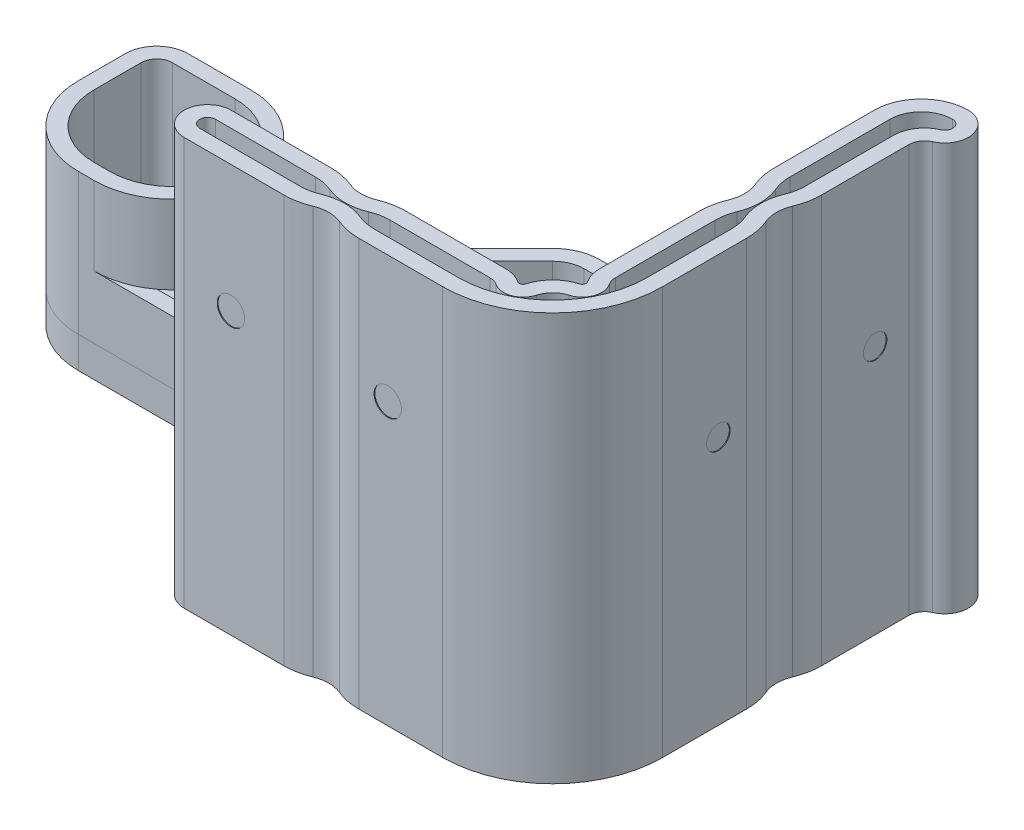
from build123d import *

# Parameters (mm, degrees)
SKETCH1_R           = 12
SKETCH1_R_2         = 2
SKETCH1_R_3         = 3
SKETCH1_R_4         = 3.05
BOSS_EXTRUDE1_DEPTH = 4
EXTRUDE_THIN1_DEPTH = 8
EXTRUDE_THIN2_DEPTH = 8
EXTRUDE_THIN3_DEPTH = 10
EXTRUDE_THIN4_DEPTH = 52
SKETCH9_R           = 1.75
CUT_EXTRUDE1_DEPTH  = 0.1
SKETCH10_R          = 1.5
SKETCH10_R_2        = 1.500000007
CUT_EXTRUDE2_DEPTH  = 0.1


with BuildPart() as part:
    # Sketch1 → Boss-Extrude1 (new body)
    with BuildSketch(Plane(origin=(0, 0, 0), x_dir=(1, 0, 0), z_dir=(0, 1, 0))):
        with BuildLine():
            Line((-56.5, 10), (-37.638467591, 10))
            ThreePointArc((-37.638467591, 10), (-33.814526369, 10.760006843), (-30.571829447, 12.924505293))
            Line((-30.571829447, 12.924505293), (-21.739982886, 21.745296824))
            ThreePointArc((-21.739982886, 21.745296824), (-19.794364733, 23.043995894), (-17.5, 23.5))
            Line((-17.5, 23.5), (17.5, 23.5))
            ThreePointArc((17.5, 23.5), (21.742640687, 21.742640687), (23.5, 17.5))
            Line((23.5, 17.5), (23.5, -17.5))
            ThreePointArc((23.5, -17.5), (21.742640687, -21.742640687), (17.5, -23.5))
            Line((17.5, -23.5), (-17.5, -23.5))
            ThreePointArc((-17.5, -23.5), (-19.794364733, -23.043995894), (-21.739982886, -21.745296824))
            Line((-21.739982886, -21.745296824), (-30.571829447, -12.924505293))
            ThreePointArc((-30.571829447, -12.924505293), (-33.814526369, -10.760006843), (-37.638467591, -10))
            Line((-37.638467591, -10), (-50.5, -10))
            ThreePointArc((-50.5, -10), (-57.571067812, -7.071067812), (-60.5, 0))
            Line((-60.5, 0), (-60.5, 6))
            ThreePointArc((-60.5, 6), (-59.328427125, 8.828427125), (-56.5, 10))
        make_face()
        with Locations(Location((0, 0, 0), (0, 0, 270))):
            Circle(SKETCH1_R, mode=Mode.SUBTRACT)
        with Locations(Location((-15.637811111, 15.662146765, 0), (0, 0, 270))):
            Circle(SKETCH1_R_2, mode=Mode.SUBTRACT)
        with Locations(Location((15.662146765, 15.637811111, 0), (0, 0, 270))):
            Circle(SKETCH1_R_2, mode=Mode.SUBTRACT)
        with Locations(Location((15.637811111, -15.662146765, 0), (0, 0, 270))):
            Circle(SKETCH1_R_2, mode=Mode.SUBTRACT)
        with Locations(Location((-15.662146765, -15.637811111, 0), (0, 0, 270))):
            Circle(SKETCH1_R_2, mode=Mode.SUBTRACT)
        with Locations(Location((-53.5, 0, 0), (0, 0, 270))):
            Circle(SKETCH1_R_3, mode=Mode.SUBTRACT)
        with Locations(Location((-33.5, 0, 0), (0, 0, 270))):
            Circle(SKETCH1_R_4, mode=Mode.SUBTRACT)
        with BuildLine():
            Line((19.5, -3), (19.5, -9.206263146))
            ThreePointArc((19.5, -9.206263146), (19.041462955, -10.046987755), (18.086364264, -10.116705609))
            ThreePointArc((18.086364264, -10.116705609), (16.465532816, -9.638381302), (14.7756495, -9.624849747))
            ThreePointArc((14.7756495, -9.624849747), (13.810727907, -9.185503496), (13.78311178, -8.125627956))
            ThreePointArc((13.78311178, -8.125627956), (14.868163127, -5.910814262), (15.599936689, -3.555555556))
            ThreePointArc((15.599936689, -3.555555556), (16.302709646, -2.43652808), (17.549928775, -2))
            Line((17.549928775, -2), (18.5, -2))
            ThreePointArc((18.5, -2), (19.207106781, -2.292893219), (19.5, -3))
        make_face(mode=Mode.SUBTRACT)
        with BuildLine():
            Line((19.5, 9.206263146), (19.5, 3))
            ThreePointArc((19.5, 3), (19.207106781, 2.292893219), (18.5, 2))
            Line((18.5, 2), (17.549928775, 2))
            ThreePointArc((17.549928775, 2), (16.302709646, 2.43652808), (15.599936689, 3.555555556))
            ThreePointArc((15.599936689, 3.555555556), (14.868163127, 5.910814262), (13.78311178, 8.125627956))
            ThreePointArc((13.78311178, 8.125627956), (13.810727907, 9.185503495), (14.7756495, 9.624849747))
            ThreePointArc((14.7756495, 9.624849747), (16.465532816, 9.638381302), (18.086364264, 10.116705609))
            ThreePointArc((18.086364264, 10.116705609), (19.041462955, 10.046987755), (19.5, 9.206263146))
        make_face(mode=Mode.SUBTRACT)
        with BuildLine():
            Line((-47.234448237, 5.968935344), (-39.813106892, 5.999991244))
            ThreePointArc((-39.813106892, 5.999991244), (-38.909524399, 5.437130986), (-39.025205203, 4.378881988))
            ThreePointArc((-39.025205203, 4.378881988), (-40.55, 0), (-39.025205203, -4.378881988))
            ThreePointArc((-39.025205203, -4.378881988), (-38.909524399, -5.437130986), (-39.813106892, -5.999991244))
            Line((-39.813106892, -5.999991244), (-47.234448237, -5.968935344))
            ThreePointArc((-47.234448237, -5.968935344), (-48.131482814, -5.402307604), (-48.013980649, -4.347826087))
            ThreePointArc((-48.013980649, -4.347826087), (-46.5, 0), (-48.013980649, 4.347826087))
            ThreePointArc((-48.013980649, 4.347826087), (-48.131482814, 5.402307604), (-47.234448237, 5.968935344))
        make_face(mode=Mode.SUBTRACT)
        with BuildLine():
            Line((-3, -19.5), (-9.206263146, -19.5))
            ThreePointArc((-9.206263146, -19.5), (-10.046987755, -19.041462955), (-10.116705609, -18.086364264))
            ThreePointArc((-10.116705609, -18.086364264), (-9.638381302, -16.465532816), (-9.624849747, -14.7756495))
            ThreePointArc((-9.624849747, -14.7756495), (-9.185503496, -13.810727907), (-8.125627956, -13.78311178))
            ThreePointArc((-8.125627956, -13.78311178), (-5.910814262, -14.868163127), (-3.555555556, -15.599936689))
            ThreePointArc((-3.555555556, -15.599936689), (-2.43652808, -16.302709646), (-2, -17.549928775))
            Line((-2, -17.549928775), (-2, -18.5))
            ThreePointArc((-2, -18.5), (-2.292893219, -19.207106781), (-3, -19.5))
        make_face(mode=Mode.SUBTRACT)
        with BuildLine():
            Line((9.206263146, -19.5), (3, -19.5))
            ThreePointArc((3, -19.5), (2.292893219, -19.207106781), (2, -18.5))
            Line((2, -18.5), (2, -17.549928775))
            ThreePointArc((2, -17.549928775), (2.43652808, -16.302709646), (3.555555556, -15.599936689))
            ThreePointArc((3.555555556, -15.599936689), (5.910814262, -14.868163127), (8.125627956, -13.78311178))
            ThreePointArc((8.125627956, -13.78311178), (9.185503495, -13.810727907), (9.624849747, -14.7756495))
            ThreePointArc((9.624849747, -14.7756495), (9.638381302, -16.465532816), (10.116705609, -18.086364264))
            ThreePointArc((10.116705609, -18.086364264), (10.046987755, -19.041462955), (9.206263146, -19.5))
        make_face(mode=Mode.SUBTRACT)
        with BuildLine():
            Line((-19.5, 3), (-19.5, 9.206263146))
            ThreePointArc((-19.5, 9.206263146), (-19.041462955, 10.046987755), (-18.086364264, 10.116705609))
            ThreePointArc((-18.086364264, 10.116705609), (-16.465532816, 9.638381302), (-14.7756495, 9.624849747))
            ThreePointArc((-14.7756495, 9.624849747), (-13.810727907, 9.185503496), (-13.78311178, 8.125627956))
            ThreePointArc((-13.78311178, 8.125627956), (-14.868163127, 5.910814262), (-15.599936689, 3.555555556))
            ThreePointArc((-15.599936689, 3.555555556), (-16.302709646, 2.43652808), (-17.549928775, 2))
            Line((-17.549928775, 2), (-18.5, 2))
            ThreePointArc((-18.5, 2), (-19.207106781, 2.292893219), (-19.5, 3))
        make_face(mode=Mode.SUBTRACT)
        with BuildLine():
            Line((-19.5, -9.206263146), (-19.5, -3))
            ThreePointArc((-19.5, -3), (-19.207106781, -2.292893219), (-18.5, -2))
            Line((-18.5, -2), (-17.549928775, -2))
            ThreePointArc((-17.549928775, -2), (-16.302709646, -2.43652808), (-15.599936689, -3.555555556))
            ThreePointArc((-15.599936689, -3.555555556), (-14.868163127, -5.910814262), (-13.78311178, -8.125627956))
            ThreePointArc((-13.78311178, -8.125627956), (-13.810727907, -9.185503495), (-14.7756495, -9.624849747))
            ThreePointArc((-14.7756495, -9.624849747), (-16.465532816, -9.638381302), (-18.086364264, -10.116705609))
            ThreePointArc((-18.086364264, -10.116705609), (-19.041462955, -10.046987755), (-19.5, -9.206263146))
        make_face(mode=Mode.SUBTRACT)
        with BuildLine():
            Line((-9.206263146, 19.5), (-3, 19.5))
            ThreePointArc((-3, 19.5), (-2.292893219, 19.207106781), (-2, 18.5))
            Line((-2, 18.5), (-2, 17.549928775))
            ThreePointArc((-2, 17.549928775), (-2.43652808, 16.302709646), (-3.555555556, 15.599936689))
            ThreePointArc((-3.555555556, 15.599936689), (-5.910814262, 14.868163127), (-8.125627956, 13.78311178))
            ThreePointArc((-8.125627956, 13.78311178), (-9.185503495, 13.810727907), (-9.624849747, 14.7756495))
            ThreePointArc((-9.624849747, 14.7756495), (-9.638381302, 16.465532816), (-10.116705609, 18.086364264))
            ThreePointArc((-10.116705609, 18.086364264), (-10.046987755, 19.041462955), (-9.206263146, 19.5))
        make_face(mode=Mode.SUBTRACT)
        with BuildLine():
            Line((2, 18.5), (2, 17.549928775))
            ThreePointArc((2, 17.549928775), (2.43652808, 16.302709646), (3.555555556, 15.599936689))
            ThreePointArc((3.555555556, 15.599936689), (5.910814262, 14.868163127), (8.125627956, 13.78311178))
            ThreePointArc((8.125627956, 13.78311178), (9.185503495, 13.810727907), (9.624849747, 14.7756495))
            ThreePointArc((9.624849747, 14.7756495), (9.638381302, 16.465532816), (10.116705609, 18.086364264))
            ThreePointArc((10.116705609, 18.086364264), (10.046987755, 19.041462955), (9.206263146, 19.5))
            Line((9.206263146, 19.5), (3, 19.5))
            ThreePointArc((3, 19.5), (2.292893219, 19.207106781), (2, 18.5))
        make_face(mode=Mode.SUBTRACT)
        with BuildLine():
            Line((-23.5, -3), (-23.5, -11.922090802))
            ThreePointArc((-23.5, -11.922090802), (-24.117027295, -12.845850461), (-25.206663814, -12.629640272))
            Line((-25.206663814, -12.629640272), (-30.170133033, -7.672383945))
            ThreePointArc((-30.170133033, -7.672383945), (-30.455062302, -6.835439125), (-29.964901614, -6.099637645))
            ThreePointArc((-29.964901614, -6.099637645), (-28.170653661, -4.615253795), (-26.95785652, -2.627329193))
            ThreePointArc((-26.95785652, -2.627329193), (-26.589950578, -2.171546378), (-26.029892906, -2))
            Line((-26.029892906, -2), (-24.5, -2))
            ThreePointArc((-24.5, -2), (-23.792893219, -2.292893219), (-23.5, -3))
        make_face(mode=Mode.SUBTRACT)
        with BuildLine():
            Line((-25.206663814, 12.629640272), (-30.170133033, 7.672383945))
            ThreePointArc((-30.170133033, 7.672383945), (-30.455062302, 6.835439125), (-29.964901614, 6.099637645))
            ThreePointArc((-29.964901614, 6.099637645), (-28.170653661, 4.615253795), (-26.95785652, 2.627329193))
            ThreePointArc((-26.95785652, 2.627329193), (-26.589950578, 2.171546378), (-26.029892906, 2))
            Line((-26.029892906, 2), (-24.5, 2))
            ThreePointArc((-24.5, 2), (-23.792893219, 2.292893219), (-23.5, 3))
            Line((-23.5, 3), (-23.5, 11.922090802))
            ThreePointArc((-23.5, 11.922090802), (-24.117027295, 12.845850461), (-25.206663814, 12.629640272))
        make_face(mode=Mode.SUBTRACT)
    extrude(amount=BOSS_EXTRUDE1_DEPTH)


with BuildPart() as body_2:
    # Sketch4 → Extrude-Thin1 (new body)
    with BuildSketch(Plane(origin=(0, 4, 0), x_dir=(1, 0, 0), z_dir=(0, 1, 0))):
        with BuildLine():
            Line((-21.739982886, 21.745296824), (-30.571829447, 12.924505293))
            ThreePointArc((-30.571829447, 12.924505293), (-33.814526369, 10.760006843), (-37.638467591, 10))
            Line((-37.638467591, 10), (-56.5, 10))
            ThreePointArc((-56.5, 10), (-59.328427125, 8.828427125), (-60.5, 6))
            Line((-60.5, 6), (-60.5, 0))
            ThreePointArc((-60.5, 0), (-57.571067812, -7.071067812), (-50.5, -10))
            Line((-50.5, -10), (-37.638467591, -10))
            ThreePointArc((-37.638467591, -10), (-33.814526369, -10.760006843), (-30.571829447, -12.924505293))
            Line((-30.571829447, -12.924505293), (-21.739982886, -21.745296824))
            ThreePointArc((-21.739982886, -21.745296824), (-19.794364733, -23.043995894), (-17.5, -23.5))
            Line((-17.5, -23.5), (17.5, -23.5))
            ThreePointArc((17.5, -23.5), (21.742640687, -21.742640687), (23.5, -17.5))
            Line((23.5, -17.5), (23.5, 17.5))
            ThreePointArc((23.5, 17.5), (21.742640687, 21.742640687), (17.5, 23.5))
            Line((17.5, 23.5), (-17.5, 23.5))
            ThreePointArc((-17.5, 23.5), (-19.794364733, 23.043995894), (-21.739982886, 21.745296824))
        make_face()
        with BuildLine():
            Line((-20.326655258, 20.330197883), (-29.158501818, 11.509406352))
            ThreePointArc((-29.158501818, 11.509406352), (-33.049738125, 8.912008212), (-37.638467591, 8))
            Line((-37.638467591, 8), (-56.5, 8))
            ThreePointArc((-56.5, 8), (-57.914213562, 7.414213562), (-58.5, 6))
            Line((-58.5, 6), (-58.5, 0))
            ThreePointArc((-58.5, 0), (-56.156854249, -5.656854249), (-50.5, -8))
            Line((-50.5, -8), (-37.638467591, -8))
            ThreePointArc((-37.638467591, -8), (-33.049738125, -8.912008212), (-29.158501818, -11.509406352))
            Line((-29.158501818, -11.509406352), (-20.326655258, -20.330197883))
            ThreePointArc((-20.326655258, -20.330197883), (-19.029576489, -21.195997263), (-17.5, -21.5))
            Line((-17.5, -21.5), (17.5, -21.5))
            ThreePointArc((17.5, -21.5), (20.328427125, -20.328427125), (21.5, -17.5))
            Line((21.5, -17.5), (21.5, 17.5))
            ThreePointArc((21.5, 17.5), (20.328427125, 20.328427125), (17.5, 21.5))
            Line((17.5, 21.5), (-17.5, 21.5))
            ThreePointArc((-17.5, 21.5), (-19.029576489, 21.195997263), (-20.326655258, 20.330197883))
        make_face(mode=Mode.SUBTRACT)
    extrude(amount=EXTRUDE_THIN1_DEPTH)



with BuildPart() as body_3:
    # Sketch5 → Extrude-Thin2 (new body)
    with BuildSketch(Plane(origin=(0, 4, 0), x_dir=(1, 0, 0), z_dir=(0, 1, 0))):
        with BuildLine():
            Line((-26.219991443, 14.302905651), (-29.087835437, 11.438651405))
            ThreePointArc((-29.087835437, 11.438651405), (-30.624783425, 10.140069248), (-32.355673589, 9.114133588))
            Line((-32.355673589, 9.114133588), (-36.861778001, 6.927369535))
            ThreePointArc((-36.861778001, 6.927369535), (-41.2, 0), (-36.861778001, -6.927369535))
            Line((-36.861778001, -6.927369535), (-32.355673589, -9.114133588))
            ThreePointArc((-32.355673589, -9.114133588), (-30.624783425, -10.140069248), (-29.087835437, -11.438651405))
            Line((-29.087835437, -11.438651405), (-26.219991443, -14.302905651))
            ThreePointArc((-26.219991443, -14.302905651), (-22.951081885, -14.951536215), (-21.1, -12.180257239))
            Line((-21.1, -12.180257239), (-21.1, 12.180257239))
            ThreePointArc((-21.1, 12.180257239), (-22.951081885, 14.951536215), (-26.219991443, 14.302905651))
        make_face()
        with BuildLine():
            Line((-24.806663814, 12.887806709), (-27.674507808, 10.023552464))
            ThreePointArc((-27.674507808, 10.023552464), (-29.465496786, 8.510328628), (-31.482484498, 7.314816826))
            Line((-31.482484498, 7.314816826), (-35.98858891, 5.128052772))
            ThreePointArc((-35.98858891, 5.128052772), (-39.2, 0), (-35.98858891, -5.128052773))
            Line((-35.98858891, -5.128052773), (-31.482484498, -7.314816826))
            ThreePointArc((-31.482484498, -7.314816826), (-29.465496786, -8.510328628), (-27.674507808, -10.023552464))
            Line((-27.674507808, -10.023552464), (-24.806663814, -12.887806709))
            ThreePointArc((-24.806663814, -12.887806709), (-23.717027295, -13.104016897), (-23.1, -12.180257239))
            Line((-23.1, -12.180257239), (-23.1, 12.180257239))
            ThreePointArc((-23.1, 12.180257239), (-23.717027295, 13.104016897), (-24.806663814, 12.887806709))
        make_face(mode=Mode.SUBTRACT)
    extrude(amount=EXTRUDE_THIN2_DEPTH)


with BuildPart() as body_2_1:
    add(body_2.part)

    add(body_3.part)  # Extrude-Thin3 merges body 3
    # Sketch7 → Extrude-Thin3 (add)
    with BuildSketch(Plane(origin=(0, 12, 0), x_dir=(1, 0, 0), z_dir=(0, 1, 0))):
        with BuildLine():
            Line((-56.5, 10), (-48.5, 10))
            ThreePointArc((-48.5, 10), (-38.46200433, 0), (-48.5, -10))
            Line((-48.5, -10), (-50.5, -10))
            ThreePointArc((-50.5, -10), (-57.571067812, -7.071067812), (-60.5, 0))
            Line((-60.5, 0), (-60.5, 6))
            ThreePointArc((-60.5, 6), (-59.328427125, 8.828427125), (-56.5, 10))
        make_face()
        with BuildLine():
            Line((-56.5, 8), (-48.495996297, 8))
            ThreePointArc((-48.495996297, 8), (-40.46200433, 0), (-48.495996297, -8))
            Line((-48.495996297, -8), (-50.5, -8))
            ThreePointArc((-50.5, -8), (-56.156854249, -5.656854249), (-58.5, 0))
            Line((-58.5, 0), (-58.5, 6))
            ThreePointArc((-58.5, 6), (-57.914213562, 7.414213562), (-56.5, 8))
        make_face(mode=Mode.SUBTRACT)
    extrude(amount=EXTRUDE_THIN3_DEPTH)


with BuildPart() as body_3_2:
    # Sketch8 → Extrude-Thin4 (new body)
    with BuildSketch(Plane(origin=(0, 0, 0), x_dir=(1, 0, 0), z_dir=(0, 1, 0))):
        with BuildLine():
            Line((29.5, 15.917424305), (29.5, 4.769958071))
            ThreePointArc((29.5, 4.769958071), (29.345905488, 3.207342614), (28.889558233, 1.704924772))
            ThreePointArc((28.889558233, 1.704924772), (28.55, 0), (28.889558233, -1.704924772))
            ThreePointArc((28.889558233, -1.704924772), (29.345905488, -3.207342614), (29.5, -4.769958071))
            Line((29.5, -4.769958071), (29.5, -15.470571553))
            ThreePointArc((29.5, -15.470571553), (25.390875544, -25.390875544), (15.470571553, -29.5))
            Line((15.470571553, -29.5), (4.769958071, -29.5))
            ThreePointArc((4.769958071, -29.5), (3.207342614, -29.345905488), (1.704924772, -28.889558233))
            ThreePointArc((1.704924772, -28.889558233), (0, -28.55), (-1.704924772, -28.889558233))
            ThreePointArc((-1.704924772, -28.889558233), (-3.207342614, -29.345905488), (-4.769958071, -29.5))
            Line((-4.769958071, -29.5), (-17.5, -29.5))
            ThreePointArc((-17.5, -29.5), (-20.5, -26.5), (-17.5, -23.5))
            Line((-17.5, -23.5), (-4.769958071, -23.5))
            ThreePointArc((-4.769958071, -23.5), (-3.207342614, -23.654094512), (-1.704924772, -24.110441767))
            ThreePointArc((-1.704924772, -24.110441767), (0, -24.45), (1.704924772, -24.110441767))
            ThreePointArc((1.704924772, -24.110441767), (3.207342614, -23.654094512), (4.769958071, -23.5))
            Line((4.769958071, -23.5), (17.5, -23.5))
            ThreePointArc((17.5, -23.5), (18.657816908, -23.671232573), (19.716505831, -24.170269996))
            ThreePointArc((19.716505831, -24.170269996), (20.165650735, -24.223508639), (20.473987745, -23.892610186))
            ThreePointArc((20.473987745, -23.892610186), (21.742640687, -21.742640687), (23.892610186, -20.473987745))
            ThreePointArc((23.892610186, -20.473987745), (24.223508639, -20.165650735), (24.170269996, -19.716505831))
            ThreePointArc((24.170269996, -19.716505831), (23.671232573, -18.657816908), (23.5, -17.5))
            Line((23.5, -17.5), (23.5, -4.769958071))
            ThreePointArc((23.5, -4.769958071), (23.654094512, -3.207342614), (24.110441767, -1.704924772))
            ThreePointArc((24.110441767, -1.704924772), (24.45, 0), (24.110441767, 1.704924772))
            ThreePointArc((24.110441767, 1.704924772), (23.654094512, 3.207342614), (23.5, 4.769958071))
            Line((23.5, 4.769958071), (23.5, 17.5))
            ThreePointArc((23.5, 17.5), (25.257359313, 21.742640687), (29.5, 23.5))
            ThreePointArc((29.5, 23.5), (32.436718939, 21.112928931), (30.7, 17.750454583))
            ThreePointArc((30.7, 17.750454583), (29.826679947, 17.01286942), (29.5, 15.917424305))
        make_face()
        with BuildLine():
            Line((27.5, 15.917424305), (27.5, 4.769958071))
            ThreePointArc((27.5, 4.769958071), (27.384429116, 3.597996478), (27.042168675, 2.471183097))
            ThreePointArc((27.042168675, 2.471183097), (26.55, 0), (27.042168675, -2.471183097))
            ThreePointArc((27.042168675, -2.471183097), (27.384429116, -3.597996478), (27.5, -4.769958071))
            Line((27.5, -4.769958071), (27.5, -15.470571553))
            ThreePointArc((27.5, -15.470571553), (23.976661982, -23.976661982), (15.470571553, -27.5))
            Line((15.470571553, -27.5), (4.769958071, -27.5))
            ThreePointArc((4.769958071, -27.5), (3.597996478, -27.384429116), (2.471183097, -27.042168675))
            ThreePointArc((2.471183097, -27.042168675), (0, -26.55), (-2.471183097, -27.042168675))
            ThreePointArc((-2.471183097, -27.042168675), (-3.597996478, -27.384429116), (-4.769958071, -27.5))
            Line((-4.769958071, -27.5), (-17.5, -27.5))
            ThreePointArc((-17.5, -27.5), (-18.5, -26.5), (-17.5, -25.5))
            Line((-17.5, -25.5), (-4.769958071, -25.5))
            ThreePointArc((-4.769958071, -25.5), (-3.597996478, -25.615570884), (-2.471183097, -25.957831325))
            ThreePointArc((-2.471183097, -25.957831325), (0, -26.45), (2.471183097, -25.957831325))
            ThreePointArc((2.471183097, -25.957831325), (3.597996478, -25.615570884), (4.769958071, -25.5))
            Line((4.769958071, -25.5), (17.5, -25.5))
            ThreePointArc((17.5, -25.5), (18.078908454, -25.585616287), (18.608252916, -25.835134998))
            ThreePointArc((18.608252916, -25.835134998), (20.853977435, -26.101328213), (22.395662484, -24.446835949))
            ThreePointArc((22.395662484, -24.446835949), (23.156854249, -23.156854249), (24.446835949, -22.395662484))
            ThreePointArc((24.446835949, -22.395662484), (26.101328213, -20.853977435), (25.835134998, -18.608252916))
            ThreePointArc((25.835134998, -18.608252916), (25.585616287, -18.078908454), (25.5, -17.5))
            Line((25.5, -17.5), (25.5, -4.769958071))
            ThreePointArc((25.5, -4.769958071), (25.615570884, -3.597996478), (25.957831325, -2.471183097))
            ThreePointArc((25.957831325, -2.471183097), (26.45, 0), (25.957831325, 2.471183097))
            ThreePointArc((25.957831325, 2.471183097), (25.615570884, 3.597996478), (25.5, 4.769958071))
            Line((25.5, 4.769958071), (25.5, 17.5))
            ThreePointArc((25.5, 17.5), (26.671572875, 20.328427125), (29.5, 21.5))
            ThreePointArc((29.5, 21.5), (30.478906313, 20.704309644), (29.9, 19.583484861))
            ThreePointArc((29.9, 19.583484861), (28.153359894, 18.108314535), (27.5, 15.917424305))
        make_face(mode=Mode.SUBTRACT)
    extrude(amount=EXTRUDE_THIN4_DEPTH)

    # Sketch9 → Cut-Extrude1 (cut)
    with BuildSketch(Plane.XY.offset(29.5)):
        with Locations((8.470571553, 35.820902826)):
            Circle(SKETCH9_R)
        with Locations((-1.529428447, 35.820902826)):
            Circle(SKETCH9_R)
        with Locations((-11.529428447, 35.820902826)):
            Circle(SKETCH9_R)
    extrude(amount=-CUT_EXTRUDE1_DEPTH, mode=Mode.SUBTRACT)

    # Sketch10 → Cut-Extrude2 (cut)
    with BuildSketch(Plane(origin=(29.5, 0, 0), x_dir=(0, 0, -1), z_dir=(1, 0, 0))):
        with Locations((-8.3721283, 31.836728587)):
            Circle(SKETCH10_R)
        with Locations((1.627871692, 31.836728587)):
            Circle(SKETCH10_R_2)
        with Locations((11.6278717, 31.836728587)):
            Circle(SKETCH10_R)
    extrude(amount=-CUT_EXTRUDE2_DEPTH, mode=Mode.SUBTRACT)


solid = Compound([part.part, body_2_1.part, body_3_2.part])
